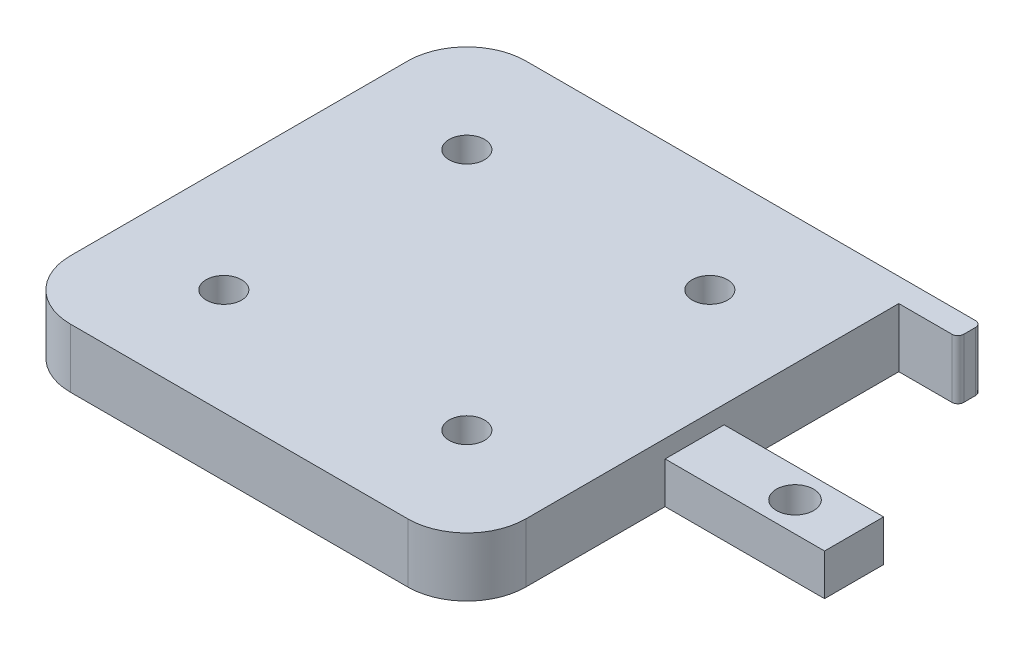
from build123d import *

# Parameters (mm, degrees)
CROQUIS1_W              = 77.15
CROQUIS1_H              = 77.15
CROQUIS1_R              = 3
SALIENTE_EXTRUIR1_DEPTH = 10
REDONDEO1_R             = 10
SALIENTE_EXTRUIR2_DEPTH = 30
CORTAR_EXTRUIR1_START   = -3
CROQUIS3_R              = 3.15
CORTAR_EXTRUIR1_DEPTH   = 5
CORTAR_EXTRUIR2_START   = -3
CROQUIS4_W              = 3
CROQUIS4_H              = 10
CORTAR_EXTRUIR2_DEPTH   = 43
CROQUIS5_W              = 4
CROQUIS5_H              = 10
SALIENTE_EXTRUIR3_DEPTH = 10
REDONDEO2_R             = 1


with BuildPart() as part:
    # Croquis1 → Saliente-Extruir1 (new body)
    with BuildSketch(Plane(origin=(0, 0, 0), x_dir=(1, 0, 0), z_dir=(0, 1, 0))):
        Rectangle(CROQUIS1_W, CROQUIS1_H)
        with Locations(Location((-20.575, -20.575, 0), (0, 0, 270))):
            Circle(CROQUIS1_R, mode=Mode.SUBTRACT)
        with Locations(Location((-20.575, 20.575, 0), (0, 0, 270))):
            Circle(CROQUIS1_R, mode=Mode.SUBTRACT)
        with Locations(Location((20.575, 20.575, 0), (0, 0, 270))):
            Circle(CROQUIS1_R, mode=Mode.SUBTRACT)
        with Locations(Location((20.575, -20.575, 0), (0, 0, 270))):
            Circle(CROQUIS1_R, mode=Mode.SUBTRACT)
    extrude(amount=SALIENTE_EXTRUIR1_DEPTH)

    # Redondeo1
    redondeo1_edges = [part.edges().sort_by_distance(p)[0] for p in [
        (-38.575, 5, 38.575),
        (-38.575, 5, -38.575),
        (38.575, 5, 38.575),
    ]]
    fillet(redondeo1_edges, radius=REDONDEO1_R)

    # Croquis2 → Saliente-Extruir2 (add)
    with BuildSketch(Plane(origin=(38.575, 0, 0), x_dir=(0, 0, -1), z_dir=(1, 0, 0))):
        Polygon((5, 0), (0, 0), (-5, 0), (-5, 7), (5, 7), align=None)
    extrude(amount=SALIENTE_EXTRUIR2_DEPTH)

    # Croquis3 → Cortar-Extruir1 (cut)
    with BuildSketch(Plane(origin=(0, 10, 0), x_dir=(1, 0, 0), z_dir=(0, 1, 0)).offset(CORTAR_EXTRUIR1_START)):
        with Locations(Location((55.575, 0, 0), (0, 0, 90))):
            Circle(CROQUIS3_R)
    extrude(amount=-CORTAR_EXTRUIR1_DEPTH, mode=Mode.SUBTRACT)

    # Croquis4 → Cortar-Extruir2 (cut)
    with BuildSketch(Plane(origin=(0, 10, 0), x_dir=(1, 0, 0), z_dir=(0, 1, 0)).offset(CORTAR_EXTRUIR2_START)):
        with Locations((67.075, 0)):
            Rectangle(CROQUIS4_W, CROQUIS4_H)
    extrude(amount=-CORTAR_EXTRUIR2_DEPTH, mode=Mode.SUBTRACT)

    # Croquis5 → Saliente-Extruir3 (add)
    with BuildSketch(Plane(origin=(38.575, 0, 0), x_dir=(0, 0, -1), z_dir=(1, 0, 0))):
        with Locations((36.575, 5)):
            Rectangle(CROQUIS5_W, CROQUIS5_H)
    extrude(amount=SALIENTE_EXTRUIR3_DEPTH)

    # Redondeo2
    redondeo2_edges = [part.edges().sort_by_distance(p)[0] for p in [
        (48.575, 5, -38.575),
        (48.575, 5, -34.575),
    ]]
    fillet(redondeo2_edges, radius=REDONDEO2_R)


solid = part.part
